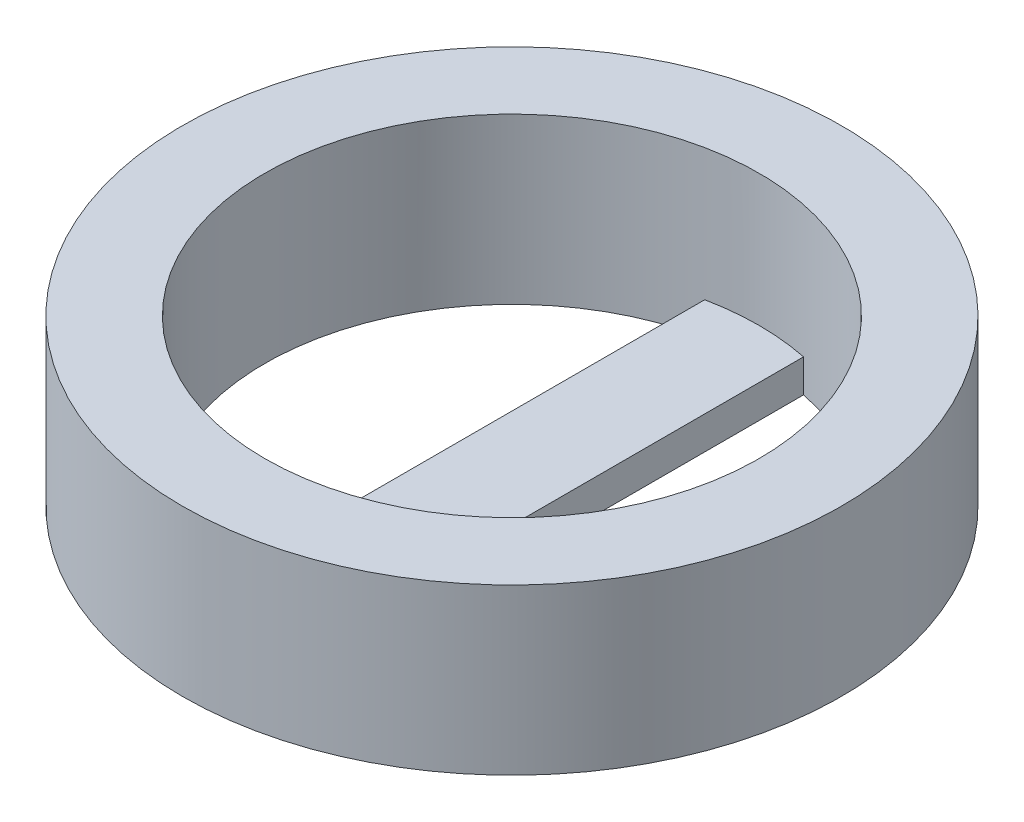
from build123d import *

# Parameters (mm, degrees)
SKETCH1_R           = 10
SKETCH1_R_2         = 7.5
BOSS_EXTRUDE1_DEPTH = 5
SKETCH2_W           = 3
SKETCH2_H           = 15
BOSS_EXTRUDE2_DEPTH = 1


with BuildPart() as part:
    # Sketch1 → Boss-Extrude1 (new body)
    with BuildSketch(Plane(origin=(0, 0, 0), x_dir=(1, 0, 0), z_dir=(0, 1, 0))):
        with Locations(Location((0, 0, 0), (0, 0, 270))):
            Circle(SKETCH1_R)
        with Locations(Location((0, 0, 0), (0, 0, 270))):
            Circle(SKETCH1_R_2, mode=Mode.SUBTRACT)
    extrude(amount=BOSS_EXTRUDE1_DEPTH)

    # Sketch2 → Boss-Extrude2 (add)
    with BuildSketch(Plane.XZ):
        Rectangle(SKETCH2_W, SKETCH2_H)
    extrude(amount=-BOSS_EXTRUDE2_DEPTH)


solid = part.part
